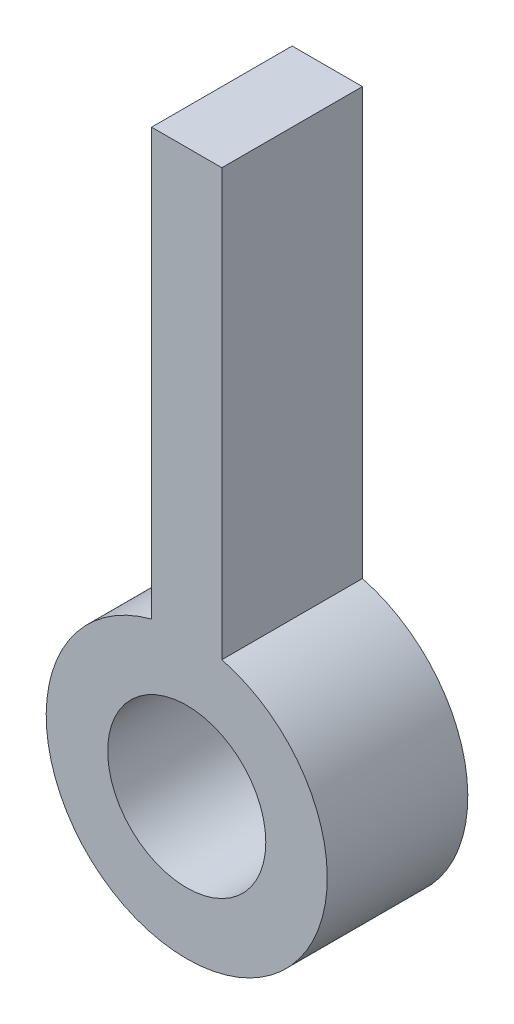
from build123d import *

# Parameters (mm, degrees)
SKETCH2_R           = 2.25
BOSS_EXTRUDE2_DEPTH = 4


with BuildPart() as part:
    # Sketch2 → Boss-Extrude2 (new body)
    with BuildSketch(Plane(origin=(0, 0, 0), x_dir=(0, 1, 0), z_dir=(0, 0, 1))):
        with BuildLine():
            Line((3.872983346, 1), (16, 1))
            Line((16, 1), (16, -1))
            Line((16, -1), (3.872983346, -1))
            ThreePointArc((3.872983346, -1), (-4, 0), (3.872983346, 1))
        make_face()
        with Locations(Location((0, 0, 0), (0, 0, 270))):
            Circle(SKETCH2_R, mode=Mode.SUBTRACT)
    extrude(amount=BOSS_EXTRUDE2_DEPTH)


solid = part.part
